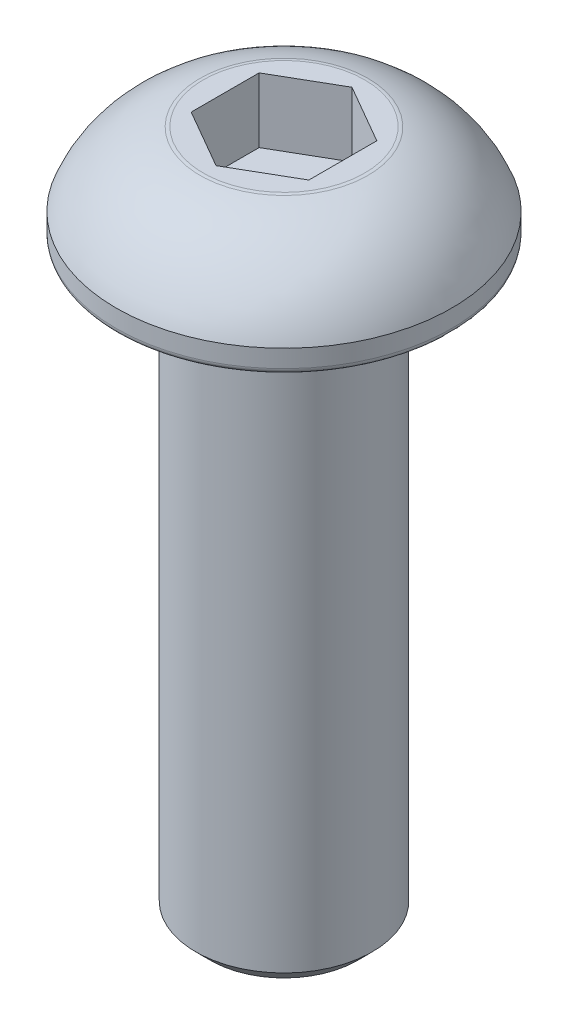
from build123d import *

# Parameters (mm, degrees)
CUT_EXTRUDE1_DEPTH = 1.1


with BuildPart() as part:
    # Sketch1 → Revolve1 (revolve)
    with BuildSketch(Plane.XY, mode=Mode.PRIVATE) as revolve1_sk:
        with BuildLine():
            Line((-1.5, -0.1), (-1.5, -9.75))
            Line((-1.5, -9.75), (-1.25, -10))
            Line((-1.25, -10), (0, -10))
            Line((0, -10), (0, 1.65))
            Line((0, 1.65), (-1.372450351, 1.65))
            ThreePointArc((-1.372450351, 1.65), (-1.400779398, 1.648389744), (-1.42874351, 1.643579721))
            ThreePointArc((-1.42874351, 1.643579721), (-2.295395633, 1.200105689), (-2.85, 0.4))
            Line((-2.85, 0.4), (-2.85, 0.1))
            ThreePointArc((-2.85, 0.1), (-2.820710678, 0.029289322), (-2.75, 0))
            Line((-2.75, 0), (-1.6, 0))
            ThreePointArc((-1.6, 0), (-1.529289322, -0.029289322), (-1.5, -0.1))
        make_face()
    revolve(revolve1_sk.sketch.rotate(Axis((0, -10, 0), (0, 1, 0)), 270), axis=Axis((0, -10, 0), (0, 1, 0)))

    # Sketch2 → Cut-Extrude1 (cut)
    with BuildSketch(Plane(origin=(0, 1.65, 0), x_dir=(1, 0, 0), z_dir=(0, 1, 0))):
        Polygon((-1, 0.577350269), (-1, -0.577350269), (0, -1.154700538), (1, -0.577350269), (1, 0.577350269), (0, 1.154700538), align=None)
    extrude(amount=-CUT_EXTRUDE1_DEPTH, mode=Mode.SUBTRACT)


solid = part.part
